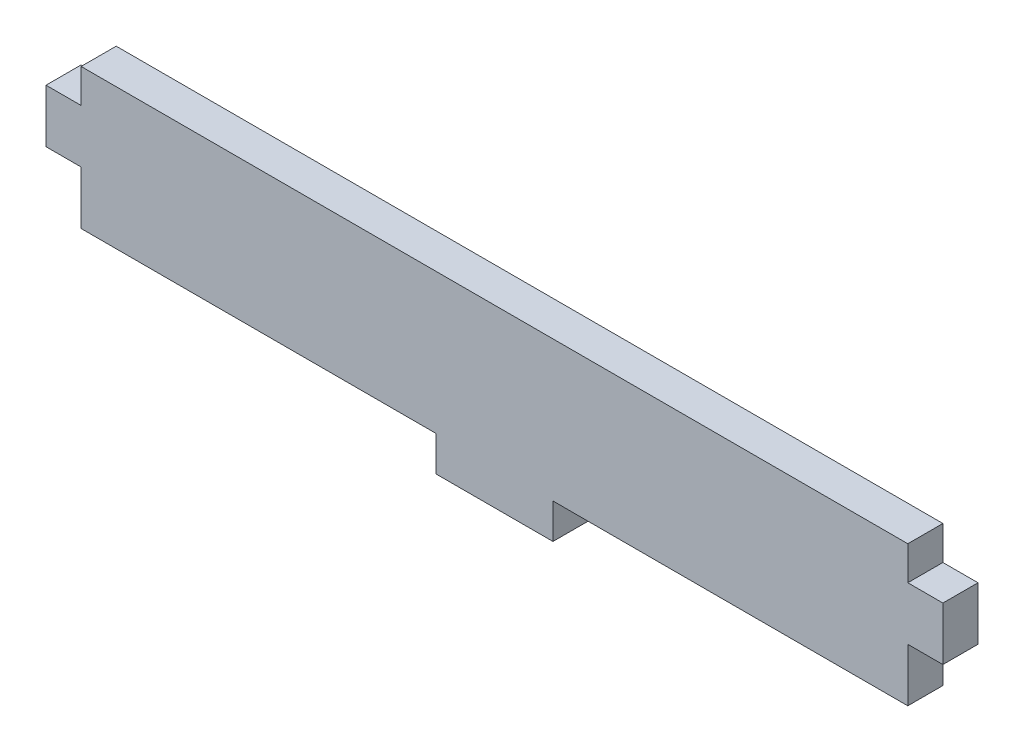
from build123d import *

# Parameters (mm, degrees)
SKETCH1_W           = 9
SKETCH1_H           = 13.666666666
SKETCH1_W_2         = 30
SKETCH1_H_2         = 9
BOSS_EXTRUDE1_DEPTH = 9


with BuildPart() as part:
    # Sketch1 → Boss-Extrude1 (new body)
    with BuildSketch(Plane.XY):
        Polygon((9, 9), (100, 9), (130, 9), (221, 9), (221, 22.666666667), (221, 36.333333333), (221, 45), (9, 45), (9, 36.333333333), (9, 22.666666667), align=None)
        with Locations((4.5, 29.5)):
            Rectangle(SKETCH1_W, SKETCH1_H)
        with Locations((115, 4.5)):
            Rectangle(SKETCH1_W_2, SKETCH1_H_2)
        with Locations((225.5, 29.5)):
            Rectangle(SKETCH1_W, SKETCH1_H)
    extrude(amount=BOSS_EXTRUDE1_DEPTH)


solid = part.part
